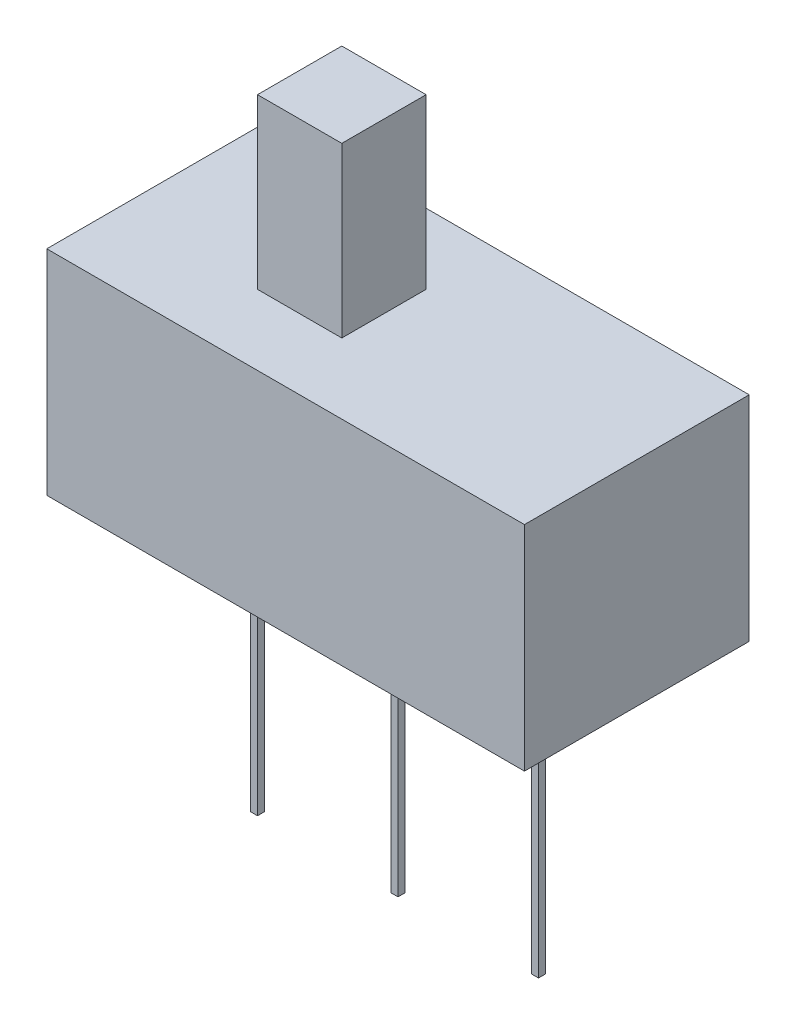
from build123d import *

# Parameters (mm, degrees)
SKETCH1_W           = 8.5
SKETCH1_H           = 3.8
BOSS_EXTRUDE1_DEPTH = 2
SKETCH2_W           = 1.5
SKETCH2_H           = 1.5
BOSS_EXTRUDE2_DEPTH = 3
SKETCH3_W           = 0.125
SKETCH3_H           = 0.125
BOSS_EXTRUDE3_DEPTH = 5


with BuildPart() as part:
    # Sketch1 → Boss-Extrude1 (new, symmetric)
    with BuildSketch(Plane.XY):
        Rectangle(SKETCH1_W, SKETCH1_H)
    extrude(amount=BOSS_EXTRUDE1_DEPTH, both=True)

    # Sketch2 → Boss-Extrude2 (add)
    with BuildSketch(Plane(origin=(0, 1.9, 0), x_dir=(1, 0, 0), z_dir=(0, 1, 0))):
        with Locations((-1, 0)):
            Rectangle(SKETCH2_W, SKETCH2_H)
    extrude(amount=BOSS_EXTRUDE2_DEPTH)

    # Sketch3 → Boss-Extrude3 (add)
    with BuildSketch(Plane.XZ.offset(1.9)):
        Rectangle(SKETCH3_W, SKETCH3_H)
        with Locations((-2.5, 0)):
            Rectangle(SKETCH3_W, SKETCH3_H)
        with Locations((2.5, 0)):
            Rectangle(SKETCH3_W, SKETCH3_H)
    extrude(amount=BOSS_EXTRUDE3_DEPTH)


solid = part.part
